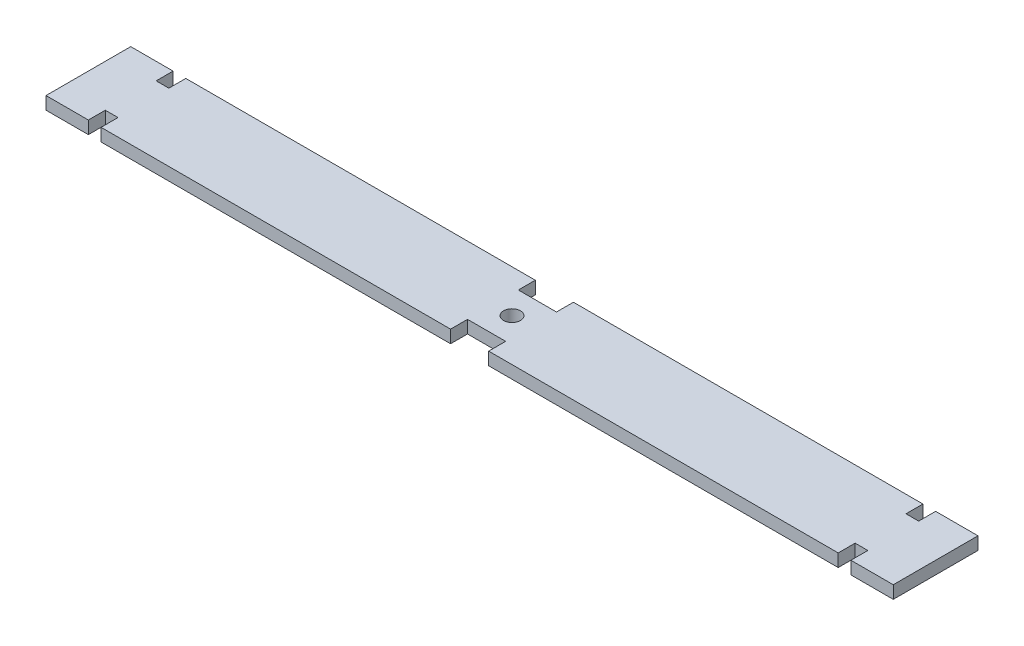
from build123d import *

# Parameters (mm, degrees)
SKETCH1_W           = 100
SKETCH1_H           = 10
BOSS_EXTRUDE1_DEPTH = 1.5
SKETCH2_R           = 1
CUT_EXTRUDE2_DEPTH  = 2
SKETCH5_W           = 1.5
SKETCH5_H           = 2
SKETCH5_W_2         = 4.5
CUT_EXTRUDE4_DEPTH  = 2


with BuildPart() as part:
    # Sketch1 → Boss-Extrude1 (new body)
    with BuildSketch(Plane(origin=(0, 0, 0), x_dir=(1, 0, 0), z_dir=(0, 1, 0))):
        with Locations((40.170187286, 0.880693734)):
            Rectangle(SKETCH1_W, SKETCH1_H)
    extrude(amount=BOSS_EXTRUDE1_DEPTH)

    # Sketch2 → Cut-Extrude2 (cut)
    with BuildSketch(Plane(origin=(0, 1.5, 0), x_dir=(1, 0, 0), z_dir=(0, 1, 0))):
        with Locations(Location((40.170187286, 0.880693734, 0), (0, 0, 270))):
            Circle(SKETCH2_R)
    extrude(amount=-CUT_EXTRUDE2_DEPTH, mode=Mode.SUBTRACT)

    # Sketch5 → Cut-Extrude4 (cut)
    with BuildSketch(Plane(origin=(0, 1.5, 0), x_dir=(1, 0, 0), z_dir=(0, 1, 0))):
        with Locations((-4.079812714, 4.880693734)):
            Rectangle(SKETCH5_W, SKETCH5_H)
        with Locations((40.170187286, 4.880693734)):
            Rectangle(SKETCH5_W_2, SKETCH5_H)
        with Locations((84.420187286, 4.880693734)):
            Rectangle(SKETCH5_W, SKETCH5_H)
        with Locations((-4.079812714, -3.119306266)):
            Rectangle(SKETCH5_W, SKETCH5_H)
        with Locations((40.170187286, -3.119306266)):
            Rectangle(SKETCH5_W_2, SKETCH5_H)
        with Locations((84.420187286, -3.119306266)):
            Rectangle(SKETCH5_W, SKETCH5_H)
    extrude(amount=-CUT_EXTRUDE4_DEPTH, mode=Mode.SUBTRACT)


solid = part.part
